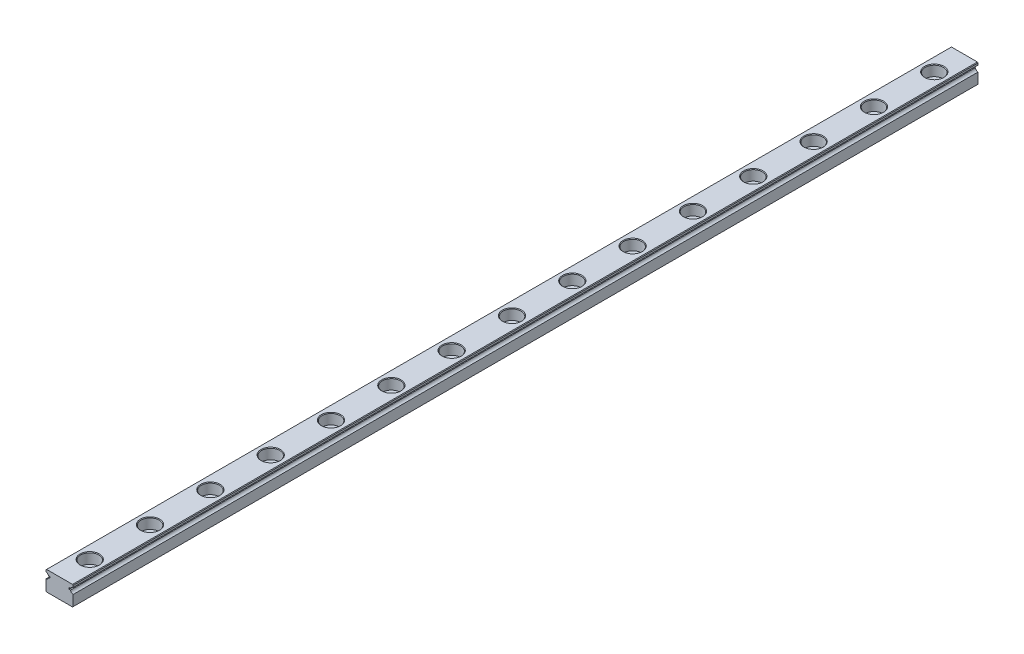
from build123d import *

# Parameters (mm, degrees)
EXTRUDE1_DEPTH             = 300
EXTRUDE2_REACH             = 302.104
SKETCH2_R                  = 1.75
SKETCH_R                   = 3
SKETCH_R_2                 = 1.75
EXTRUDE4_DEPTH             = 3.5
CHAMFER1_SIZE              = 0.2
LPATTERN1_COUNT            = 15
LPATTERN1_PITCH            = 20
CHAMFER1_OF_LPATTERN1_SIZE = 0.2


with BuildPart() as part:
    # Sketch1 → Extrude1 (new body)
    with BuildSketch(Plane.XY):
        with BuildLine():
            Line((-4.3, -3.25), (4.3, -3.25))
            Line((4.3, -3.25), (4.5, -3.05))
            Line((4.5, -3.05), (4.5, 0.455012563))
            ThreePointArc((4.5, 0.455012563), (3.924845827, 0.712323349), (3.617735397, 1.2625))
            Line((3.617735397, 1.2625), (3.15008224, 1.2625))
            Line((3.15008224, 1.2625), (3.15008224, 1.7625))
            Line((3.15008224, 1.7625), (3.65008224, 1.7625))
            ThreePointArc((3.65008224, 1.7625), (3.973877727, 2.229724887), (4.5, 2.444987437))
            Line((4.5, 2.444987437), (4.5, 3.05))
            Line((4.5, 3.05), (4.3, 3.25))
            Line((4.3, 3.25), (-4.3, 3.25))
            Line((-4.3, 3.25), (-4.5, 3.05))
            Line((-4.5, 3.05), (-4.5, 2.444987437))
            ThreePointArc((-4.5, 2.444987437), (-3.973877727, 2.229724887), (-3.65008224, 1.7625))
            Line((-3.65008224, 1.7625), (-3.15008224, 1.7625))
            Line((-3.15008224, 1.7625), (-3.15008224, 1.2625))
            Line((-3.15008224, 1.2625), (-3.617735397, 1.2625))
            ThreePointArc((-3.617735397, 1.2625), (-3.924845827, 0.712323349), (-4.5, 0.455012563))
            Line((-4.5, 0.455012563), (-4.5, -3.05))
            Line((-4.5, -3.05), (-4.3, -3.25))
        make_face()
    extrude(amount=EXTRUDE1_DEPTH)

    # Sketch2 → Extrude2 (cut, up to next)
    with BuildSketch(Plane(origin=(0, 3.25, 0), x_dir=(1, 0, 0), z_dir=(0, 1, 0)), mode=Mode.PRIVATE) as extrude2_sk1:
        with Locations((0, -10)):
            Circle(SKETCH2_R)
    extrude2_tool1 = extrude(extrude2_sk1.sketch, amount=-EXTRUDE2_REACH, mode=Mode.PRIVATE) & part.part
    extrude2 = extrude2_tool1.solids().sort_by_distance((0, 3.25, 10))[0]
    add(extrude2, mode=Mode.SUBTRACT)

    # Sketch → Extrude4 (cut)
    with BuildSketch(Plane(origin=(0, 3.25, 0), x_dir=(1, 0, 0), z_dir=(0, 1, 0))):
        with Locations((0, -10)):
            Circle(SKETCH_R)
        with Locations((0, -10)):
            Circle(SKETCH_R_2, mode=Mode.SUBTRACT)
    extrude4 = extrude(amount=-EXTRUDE4_DEPTH, mode=Mode.SUBTRACT)

    # Chamfer1
    chamfer1_edges = [part.edges().sort_by_distance(p)[0] for p in [
        (-1.75, -3.25, 10),
        (-3, 3.25, 10),
    ]]
    chamfer(chamfer1_edges, length=CHAMFER1_SIZE)

    # LPattern1: Extrude2, Extrude4 ×15
    with Locations(*[(0, 0, i * LPATTERN1_PITCH) for i in range(1, LPATTERN1_COUNT)]):
        add(extrude2, mode=Mode.SUBTRACT)
        add(extrude4, mode=Mode.SUBTRACT)

    # Chamfer1 of LPattern1
    chamfer1_of_lpattern1_edges = [part.edges().sort_by_distance(p)[0] for p in [
        (-1.75, -3.25, 30),
        (-3, 3.25, 30),
        (-1.75, -3.25, 50),
        (-3, 3.25, 50),
        (-1.75, -3.25, 70),
        (-3, 3.25, 70),
        (-1.75, -3.25, 90),
        (-3, 3.25, 90),
        (-1.75, -3.25, 110),
        (-3, 3.25, 110),
        (-1.75, -3.25, 130),
        (-3, 3.25, 130),
        (-1.75, -3.25, 150),
        (-3, 3.25, 150),
        (-1.75, -3.25, 170),
        (-3, 3.25, 170),
        (-1.75, -3.25, 190),
        (-3, 3.25, 190),
        (-1.75, -3.25, 210),
        (-3, 3.25, 210),
        (-1.75, -3.25, 230),
        (-3, 3.25, 230),
        (-1.75, -3.25, 250),
        (-3, 3.25, 250),
        (-1.75, -3.25, 270),
        (-3, 3.25, 270),
        (-1.75, -3.25, 290),
        (-3, 3.25, 290),
    ]]
    chamfer(chamfer1_of_lpattern1_edges, length=CHAMFER1_OF_LPATTERN1_SIZE)


solid = part.part
